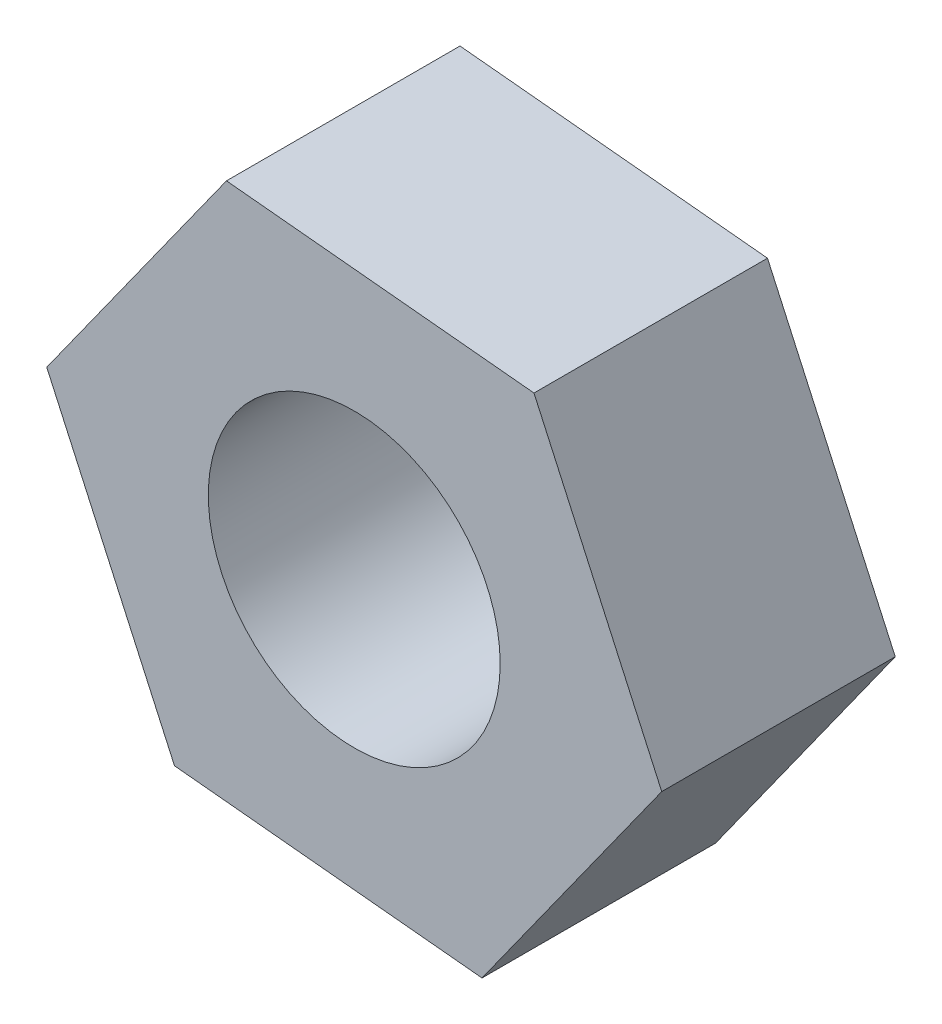
from build123d import *

# Parameters (mm, degrees)
ESQUISSE1_R        = 1.5
BOSS_EXTRU_1_DEPTH = 2.4


with BuildPart() as part:
    # Esquisse1 → Boss.-Extru.1 (new body)
    with BuildSketch(Plane.XY):
        Polygon((1.847313674, 2.582782516), (-1.313098434, 2.891211828), (-3.160412108, 0.308429313), (-1.847313674, -2.582782516), (1.313098434, -2.891211828), (3.160412108, -0.308429313), align=None)
        Circle(ESQUISSE1_R, mode=Mode.SUBTRACT)
    extrude(amount=BOSS_EXTRU_1_DEPTH)


solid = part.part
